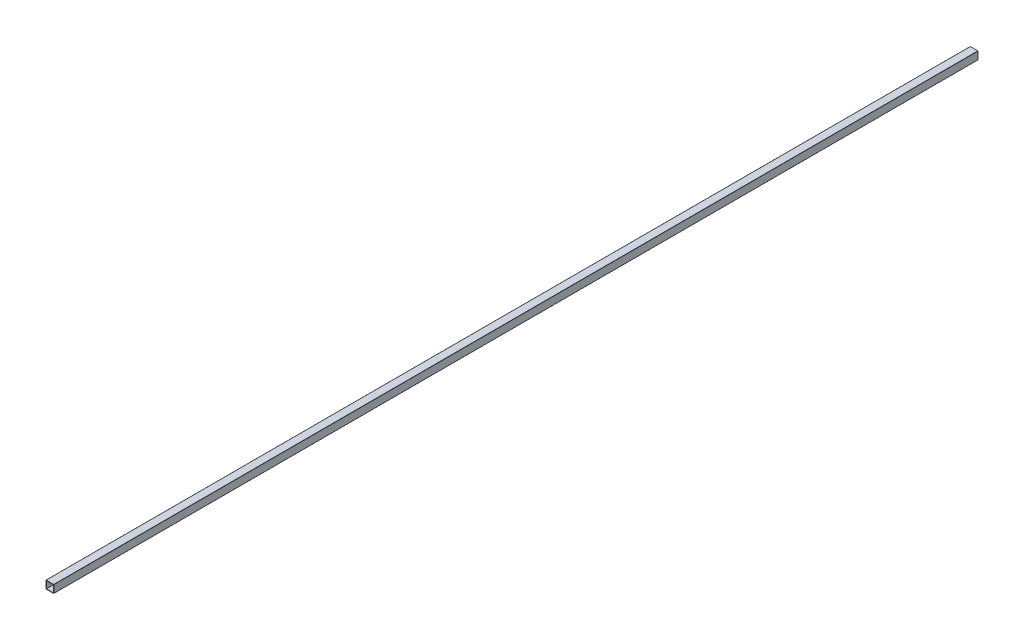
from build123d import *

# Parameters (mm, degrees)
CROQUIS1_W              = 45.48
CROQUIS1_H              = 45.48
SALIENTE_EXTRUIR1_DEPTH = 6000


with BuildPart() as part:
    # Croquis1 → Saliente-Extruir1 (new body)
    with BuildSketch(Plane.XY):
        with BuildLine():
            Line((-24.4, -25.4), (24.4, -25.4))
            ThreePointArc((24.4, -25.4), (25.107106781, -25.107106781), (25.4, -24.4))
            Line((25.4, -24.4), (25.4, 24.4))
            ThreePointArc((25.4, 24.4), (25.107106781, 25.107106781), (24.4, 25.4))
            Line((24.4, 25.4), (-24.4, 25.4))
            ThreePointArc((-24.4, 25.4), (-25.107106781, 25.107106781), (-25.4, 24.4))
            Line((-25.4, 24.4), (-25.4, -24.4))
            ThreePointArc((-25.4, -24.4), (-25.107106781, -25.107106781), (-24.4, -25.4))
        make_face()
        Rectangle(CROQUIS1_W, CROQUIS1_H, mode=Mode.SUBTRACT)
    extrude(amount=SALIENTE_EXTRUIR1_DEPTH)


solid = part.part
